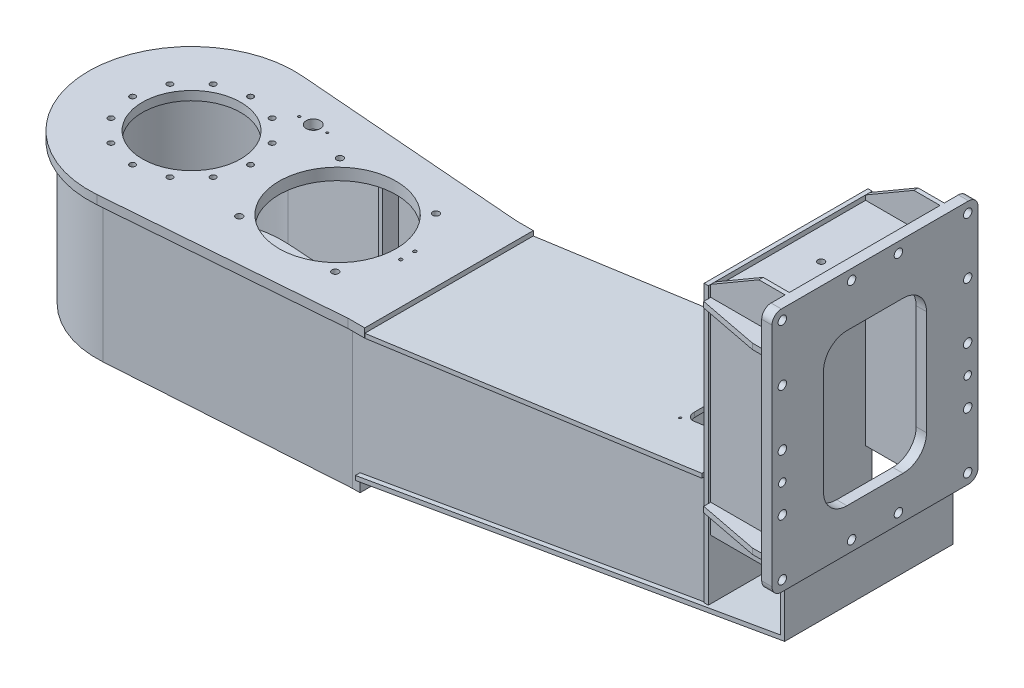
from build123d import *

# Parameters (mm, degrees)
SKETCH_1_R               = 203
SKETCH_1_R_2             = 194
EXTRUDE_1_DEPTH          = 301
CUT_EXTRUDE_1_DEPTH      = 416.955526469
CUT_EXTRUDE_1_DEPTH_BACK = 416.955526469
EXTRUDE_START            = 20
SKETCH_4_R               = 194
EXTRUDE_2_DEPTH          = 20
EXTRUDE_3_DEPTH          = 20
SKETCH_7_R               = 159
CUT_EXTRUDE_3_DEPTH      = 20
CUT_EXTRUDE_5_DEPTH      = 20
FILLET_1_R               = 25
EXTRUDE_4_DEPTH          = 301
SKETCH_11_R              = 220
EXTRUDE_5_DEPTH          = 19
EXTRUDE_6_DEPTH          = 19
SKETCH_13_W              = 300
SKETCH_13_H              = 270
EXTRUDE_7_DEPTH          = 6
EXTRUDE_8_DEPTH          = 12
CUT_EXTRUDE_7_DEPTH      = 12
EXTRUDE_9_DEPTH          = 9
EXTRUDE_10_DEPTH         = 9
EXTRUDE_11_DEPTH         = 180
EXTRUDE_11_DEPTH_BACK    = 180
EXTRUDE_12_DEPTH         = 180
EXTRUDE_12_DEPTH_BACK    = 180
EXTRUDE_13_DEPTH         = 161
EXTRUDE_13_DEPTH_BACK    = 161
CUT_EXTRUDE_8_DEPTH      = 9
SKETCH_31_W              = 350
SKETCH_31_H              = 591
EXTRUDE_14_DEPTH         = 9
EXTRUDE_16_DEPTH         = 9
EXTRUDE_17_DEPTH         = 9
EXTRUDE_18_DEPTH         = 12
EXTRUDE_19_DEPTH         = 12
SKETCH_43_W              = 159
SKETCH_43_H              = 322
EXTRUDE_20_DEPTH         = 12
EXTRUDE_21_DEPTH         = 22
CUT_EXTRUDE_10_DEPTH     = 22
EXTRUDE_22_DEPTH         = 301
SKETCH_50_R              = 105
CUT_EXTRUDE_12_DEPTH     = 19
SKETCH_52_R              = 6
CUT_EXTRUDE_14_DEPTH     = 19
SKETCH_54_R              = 15
CUT_EXTRUDE_16_DEPTH     = 19
SKETCH_56_R              = 2.5
CUT_EXTRUDE_18_DEPTH     = 19
SKETCH_59_R              = 125
CUT_EXTRUDE_20_DEPTH     = 25
SKETCH_61_R              = 7
CUT_EXTRUDE_22_DEPTH     = 25
SKETCH_63_R              = 3.4
CUT_EXTRUDE_24_DEPTH     = 25
CUT_EXTRUDE_25_DEPTH     = 9
SKETCH_65_R              = 2.5
CUT_EXTRUDE_26_DEPTH     = 9
SKETCH_67_R              = 65
CUT_EXTRUDE_28_DEPTH     = 9
SKETCH_69_R              = 2.5
CUT_EXTRUDE_30_DEPTH     = 9
SKETCH_71_R              = 7
CUT_EXTRUDE_32_DEPTH     = 12
SKETCH_73_R              = 9
CUT_EXTRUDE_34_DEPTH     = 22
SKETCH_75_R              = 8
CUT_EXTRUDE_36_DEPTH     = 22


with BuildPart() as part:
    # ｽｹｯﾁ1 → ﾎﾞｽ - 押し出し1 (new body)
    with BuildSketch(Plane(origin=(0, 0, 0), x_dir=(1, 0, 0), z_dir=(0, 1, 0))):
        with Locations(Location((0, 0, 0), (0, 0, 270))):
            Circle(SKETCH_1_R)
        with Locations(Location((0, 0, 0), (0, 0, 270))):
            Circle(SKETCH_1_R_2, mode=Mode.SUBTRACT)
    extrude(amount=-EXTRUDE_1_DEPTH)

    # ｽｹｯﾁ2 → ｶｯﾄ - 押し出し1 (cut, two sides: drawn at the far end of the back side and taken through both)
    with BuildSketch(Plane(origin=(0, 0, 0), x_dir=(1, 0, 0), z_dir=(0, 1, 0)).offset(-CUT_EXTRUDE_1_DEPTH_BACK)):
        Polygon((0, 0), (16.224897935, -249.47294981), (300, -249.47294981), (300, 249.47294981), (16.224897935, 249.47294981), align=None)
    extrude(amount=CUT_EXTRUDE_1_DEPTH + CUT_EXTRUDE_1_DEPTH_BACK, mode=Mode.SUBTRACT)

    # ｽｹｯﾁ4 → ﾎﾞｽ - 押し出し2 (add)
    with BuildSketch(Plane(origin=(0, -301, 0), x_dir=(1, 0, 0), z_dir=(0, 1, 0)).offset(EXTRUDE_START)):
        Circle(SKETCH_4_R)
    extrude(amount=-EXTRUDE_2_DEPTH)

    # ｽｹｯﾁ5 → ﾎﾞｽ - 押し出し3 (add)
    with BuildSketch(Plane(origin=(0, -301, 0), x_dir=(1, 0, 0), z_dir=(0, 1, 0))):
        Polygon((12.590520797, -193.591009053), (513.7, -161), (518, -161), (518, 161), (513.7, 161), (12.590520797, 193.591009053), align=None)
    extrude(amount=EXTRUDE_3_DEPTH)

    # ｽｹｯﾁ7 → ｶｯﾄ - 押し出し3 (cut)
    with BuildSketch(Plane(origin=(0, -301, 0), x_dir=(1, 0, 0), z_dir=(0, 1, 0))):
        with Locations(Location((0, 0, 0), (0, 0, 270))):
            Circle(SKETCH_7_R)
    extrude(amount=CUT_EXTRUDE_3_DEPTH, mode=Mode.SUBTRACT)

    # ｽｹｯﾁ9 → ｶｯﾄ - 押し出し5 (cut)
    with BuildSketch(Plane(origin=(0, -301, 0), x_dir=(1, 0, 0), z_dir=(0, 1, 0))):
        Polygon((10.319035087, -158.664796079), (468.0175, -128.897597336), (468.0175, 128.897597336), (10.319035087, 158.664796079), align=None)
    extrude(amount=CUT_EXTRUDE_5_DEPTH, mode=Mode.SUBTRACT)

    # ﾌｨﾚｯﾄ1
    fillet_1_edges = [part.edges().sort_by_distance(p)[0] for p in [
        (468.0175, -291, 128.897597336),
        (468.0175, -291, -128.897597336),
    ]]
    fillet(fillet_1_edges, radius=FILLET_1_R)

    # ｽｹｯﾁ10 → ﾎﾞｽ - 押し出し4 (add)
    with BuildSketch(Plane(origin=(0, 0, 0), x_dir=(1, 0, 0), z_dir=(0, 1, 0))):
        Polygon((12.590520797, 193.591009053), (513.7, 161), (530, 161), (530, 170), (514, 170), (13.174617123, 202.572035246), align=None)
        Polygon((12.590520797, -193.591009053), (513.7, -161), (530, -161), (530, -170), (514, -170), (13.174617123, -202.572035246), align=None)
    extrude(amount=-EXTRUDE_4_DEPTH)

    # ｽｹｯﾁ11 → ﾎﾞｽ - 押し出し5 (add)
    with BuildSketch(Plane(origin=(0, 0, 0), x_dir=(1, 0, 0), z_dir=(0, 1, 0))):
        with Locations(Location((0, 0, 0), (0, 0, 63.607016217))):
            Circle(SKETCH_11_R)
    extrude(amount=EXTRUDE_5_DEPTH)

    # ｽｹｯﾁ12 → ﾎﾞｽ - 押し出し6 (add)
    with BuildSketch(Plane(origin=(0, 0, 0), x_dir=(1, 0, 0), z_dir=(0, 1, 0))):
        Polygon((17.350560709, -219.314746524), (514.3, -180), (550, -180), (550, 180), (514.3, 180), (17.350560709, 219.314746524), align=None)
    extrude(amount=EXTRUDE_6_DEPTH)

    # ｽｹｯﾁ13 → ﾎﾞｽ - 押し出し7 (add)
    with BuildSketch(Plane(origin=(0, 0, 0), x_dir=(1, 0, 0), z_dir=(0, 1, 0))):
        with Locations((325, 0)):
            Rectangle(SKETCH_13_W, SKETCH_13_H)
    extrude(amount=-EXTRUDE_7_DEPTH)

    # ｽｹｯﾁ15 → ﾎﾞｽ - 押し出し8 (add)
    with BuildSketch(Plane(origin=(518, 0, 0), x_dir=(0, 0, -1), z_dir=(1, 0, 0))):
        Polygon((161, -301), (-161, -301), (-161, -7), (-151, 3), (151, 3), (161, -7), align=None)
    extrude(amount=EXTRUDE_8_DEPTH)

    # ｽｹｯﾁ17 → ｶｯﾄ - 押し出し7 (cut)
    with BuildSketch(Plane(origin=(518, 0, 0), x_dir=(0, 0, -1), z_dir=(1, 0, 0))):
        with BuildLine():
            Line((-111, -220), (-111, -97))
            ThreePointArc((-111, -97), (-102.213203436, -75.786796564), (-81, -67))
            Line((-81, -67), (81, -67))
            ThreePointArc((81, -67), (102.213203436, -75.786796564), (111, -97))
            Line((111, -97), (111, -220))
            ThreePointArc((111, -220), (102.213203436, -241.213203436), (81, -250))
            Line((81, -250), (-81, -250))
            ThreePointArc((-81, -250), (-102.213203436, -241.213203436), (-111, -220))
        make_face()
    extrude(amount=CUT_EXTRUDE_7_DEPTH, mode=Mode.SUBTRACT)

    # ｽｹｯﾁ20 → ﾎﾞｽ - 押し出し9 (add)
    with BuildSketch(Plane.XY.offset(161)):
        Polygon((530, -273.136944141), (1270, -143.555446343), (1270, 109.988063889), (530, 6.215108965), align=None)
    extrude(amount=EXTRUDE_9_DEPTH)

    # ｽｹｯﾁ21 → ﾎﾞｽ - 押し出し10 (add)
    with BuildSketch(Plane.XY.offset(-161)):
        Polygon((530, -273.136944141), (1270, -143.555446343), (1270, 109.988063889), (530, 6.215108965), align=None)
    extrude(amount=-EXTRUDE_10_DEPTH)

    # ｽｹｯﾁ22 → ﾎﾞｽ - 押し出し11 (add, two sides: drawn at the far end of the back side and taken through both)
    with BuildSketch(Plane.XY.offset(-EXTRUDE_11_DEPTH_BACK)):
        Polygon((551.2, 0.1), (1270, 100.9), (1270, 109.988063889), (549.950126354, 9.012789455), align=None)
    extrude(amount=EXTRUDE_11_DEPTH + EXTRUDE_11_DEPTH_BACK)

    # ｽｹｯﾁ23 → ﾎﾞｽ - 押し出し12 (add, two sides: drawn at the far end of the back side and taken through both)
    with BuildSketch(Plane.XY.offset(-EXTRUDE_12_DEPTH_BACK)):
        Polygon((530, -264), (1438, -105), (1438, -5), (1447, -5), (1447, -112.560952951), (530, -273.136944141), align=None)
    extrude(amount=EXTRUDE_12_DEPTH + EXTRUDE_12_DEPTH_BACK)

    # ｽｹｯﾁ24 → ﾎﾞｽ - 押し出し13 (add, two sides: drawn at the far end of the back side and taken through both)
    with BuildSketch(Plane.XY.offset(-EXTRUDE_13_DEPTH_BACK)):
        Polygon((909.050126354, 59.370719338), (917.962915808, 60.620592985), (954.346576527, -198.829559044), (945.476333395, -200.382828491), align=None)
    extrude(amount=EXTRUDE_13_DEPTH + EXTRUDE_13_DEPTH_BACK)

    # ｽｹｯﾁ29 → ｶｯﾄ - 押し出し8 (cut)
    with BuildSketch(Plane(origin=(908.595975782, 127.41579627, 0), x_dir=(0, 0, -1), z_dir=(0.9903099394368974, 0.1388748496038389, 0))):
        with BuildLine():
            Line((81, -270.017190662), (-81, -270.017190662))
            ThreePointArc((-81, -270.017190662), (-102.213203436, -261.230394097), (-111, -240.017190662))
            Line((-111, -240.017190662), (-111, -157.017190662))
            ThreePointArc((-111, -157.017190662), (-102.213203436, -135.803987226), (-81, -127.017190662))
            Line((-81, -127.017190662), (81, -127.017190662))
            ThreePointArc((81, -127.017190662), (102.213203436, -135.803987226), (111, -157.017190662))
            Line((111, -157.017190662), (111, -240.017190662))
            ThreePointArc((111, -240.017190662), (102.213203436, -261.230394097), (81, -270.017190662))
        make_face()
    extrude(amount=-CUT_EXTRUDE_8_DEPTH, mode=Mode.SUBTRACT)

    # ｽｹｯﾁ31 → ﾎﾞｽ - 押し出し14 (add)
    with BuildSketch(Plane(origin=(1270, 0, 0), x_dir=(0, 0, -1), z_dir=(1, 0, 0))):
        with Locations((0, 163.5)):
            Rectangle(SKETCH_31_W, SKETCH_31_H)
    extrude(amount=EXTRUDE_14_DEPTH)

    # ｽｹｯﾁ36 → ﾎﾞｽ - 押し出し16 (add)
    with BuildSketch(Plane.XY.offset(161)):
        Polygon((1279, -5), (1460, -5), (1460, 519), (1382, 519), (1279, 459), align=None)
    extrude(amount=EXTRUDE_16_DEPTH)

    # ｽｹｯﾁ37 → ﾎﾞｽ - 押し出し17 (add)
    with BuildSketch(Plane.XY.offset(-161)):
        Polygon((1279, -5), (1460, -5), (1460, 519), (1382, 519), (1279, 459), align=None)
    extrude(amount=-EXTRUDE_17_DEPTH)

    # ｽｹｯﾁ39 → ﾎﾞｽ - 押し出し18 (add)
    with BuildSketch(Plane(origin=(0, 44, 0), x_dir=(1, 0, 0), z_dir=(0, 1, 0))):
        Polygon((1279, 170), (1431, 170), (1438, 177), (1438, 203), (1431, 210), (1408, 210), (1279, 185), align=None)
        Polygon((1279, -170), (1431, -170), (1438, -177), (1438, -203), (1431, -210), (1408, -210), (1279, -185), align=None)
    extrude(amount=EXTRUDE_18_DEPTH)

    # ｽｹｯﾁ41 → ﾎﾞｽ - 押し出し19 (add)
    with BuildSketch(Plane(origin=(0, 423, 0), x_dir=(1, 0, 0), z_dir=(0, 1, 0))):
        Polygon((1279, 170), (1431, 170), (1438, 177), (1438, 203), (1431, 210), (1408, 210), (1279, 185), align=None)
        Polygon((1279, -170), (1431, -170), (1438, -177), (1438, -203), (1431, -210), (1408, -210), (1279, -185), align=None)
    extrude(amount=EXTRUDE_19_DEPTH)

    # ｽｹｯﾁ43 → ﾎﾞｽ - 押し出し20 (add)
    with BuildSketch(Plane(origin=(0, 437, 0), x_dir=(1, 0, 0), z_dir=(0, 1, 0))):
        with Locations((1358.5, 0)):
            Rectangle(SKETCH_43_W, SKETCH_43_H)
    extrude(amount=EXTRUDE_20_DEPTH)

    # ｽｹｯﾁ45 → ﾎﾞｽ - 押し出し21 (add)
    with BuildSketch(Plane(origin=(1438, 0, 0), x_dir=(0, 0, -1), z_dir=(1, 0, 0))):
        with BuildLine():
            Line((-220, 15), (-220, 499))
            ThreePointArc((-220, 499), (-214.142135624, 513.142135624), (-200, 519))
            Line((-200, 519), (200, 519))
            ThreePointArc((200, 519), (214.142135624, 513.142135624), (220, 499))
            Line((220, 499), (220, 15))
            ThreePointArc((220, 15), (214.142135624, 0.857864376), (200, -5))
            Line((200, -5), (-200, -5))
            ThreePointArc((-200, -5), (-214.142135624, 0.857864376), (-220, 15))
        make_face()
    extrude(amount=EXTRUDE_21_DEPTH)

    # ｽｹｯﾁ47 → ｶｯﾄ - 押し出し10 (cut)
    with BuildSketch(Plane(origin=(1438, 0, 0), x_dir=(0, 0, -1), z_dir=(1, 0, 0))):
        with BuildLine():
            Line((-110, 135), (-110, 359))
            ThreePointArc((-110, 359), (-95.355339059, 394.355339059), (-60, 409))
            Line((-60, 409), (60, 409))
            ThreePointArc((60, 409), (95.355339059, 394.355339059), (110, 359))
            Line((110, 359), (110, 135))
            ThreePointArc((110, 135), (95.355339059, 99.644660941), (60, 85))
            Line((60, 85), (-60, 85))
            ThreePointArc((-60, 85), (-95.355339059, 99.644660941), (-110, 135))
        make_face()
    extrude(amount=CUT_EXTRUDE_10_DEPTH, mode=Mode.SUBTRACT)

    # ｽｹｯﾁ48 → ﾎﾞｽ - 押し出し22 (add)
    with BuildSketch(Plane(origin=(0, 0, 0), x_dir=(1, 0, 0), z_dir=(0, 1, 0))):
        Polygon((253.6175, 145.9656), (262.6175, 145.3656), (264.7175, 177.193501799), (255.7175, 177.778832118), align=None)
        Polygon((253.6175, -145.9656), (262.6175, -145.3656), (264.7175, -177.193501799), (255.7175, -177.778832118), align=None)
    extrude(amount=-EXTRUDE_22_DEPTH)

    # ｽｹｯﾁ50 → ｶｯﾄ - 押し出し12 (cut)
    with BuildSketch(Plane(origin=(0, 0, 0), x_dir=(1, 0, 0), z_dir=(0, 1, 0))):
        with Locations(Location((0, 0, 0), (0, 0, 270))):
            Circle(SKETCH_50_R)
    extrude(amount=CUT_EXTRUDE_12_DEPTH, mode=Mode.SUBTRACT)

    # ｽｹｯﾁ52 → ｶｯﾄ - 押し出し14 (cut)
    with BuildSketch(Plane(origin=(0, 0, 0), x_dir=(1, 0, 0), z_dir=(0, 1, 0))):
        with Locations(Location((126, 0, 0), (0, 0, 270))):
            Circle(SKETCH_52_R)
        with Locations(Location((109.119200877, -63, 0), (0, 0, 270))):
            Circle(SKETCH_52_R)
        with Locations(Location((63, -109.119200877, 0), (0, 0, 270))):
            Circle(SKETCH_52_R)
        with Locations(Location((0, -126, 0), (0, 0, 270))):
            Circle(SKETCH_52_R)
        with Locations(Location((-63, -109.119200877, 0), (0, 0, 270))):
            Circle(SKETCH_52_R)
        with Locations(Location((-109.119200877, -63, 0), (0, 0, 270))):
            Circle(SKETCH_52_R)
        with Locations(Location((-126, 0, 0), (0, 0, 270))):
            Circle(SKETCH_52_R)
        with Locations(Location((-109.119200877, 63, 0), (0, 0, 270))):
            Circle(SKETCH_52_R)
        with Locations(Location((-63, 109.119200877, 0), (0, 0, 270))):
            Circle(SKETCH_52_R)
        with Locations(Location((0, 126, 0), (0, 0, 270))):
            Circle(SKETCH_52_R)
        with Locations(Location((63, 109.119200877, 0), (0, 0, 270))):
            Circle(SKETCH_52_R)
        with Locations(Location((109.119200877, 63, 0), (0, 0, 270))):
            Circle(SKETCH_52_R)
    extrude(amount=CUT_EXTRUDE_14_DEPTH, mode=Mode.SUBTRACT)

    # ｽｹｯﾁ54 → ｶｯﾄ - 押し出し16 (cut)
    with BuildSketch(Plane(origin=(0, 0, 0), x_dir=(1, 0, 0), z_dir=(0, 1, 0))):
        with Locations(Location((119, 141, 0), (0, 0, 270))):
            Circle(SKETCH_54_R)
    extrude(amount=CUT_EXTRUDE_16_DEPTH, mode=Mode.SUBTRACT)

    # ｽｹｯﾁ56 → ｶｯﾄ - 押し出し18 (cut)
    with BuildSketch(Plane(origin=(0, 0, 0), x_dir=(1, 0, 0), z_dir=(0, 1, 0))):
        with Locations(Location((89, 141, 0), (0, 0, 270))):
            Circle(SKETCH_56_R)
        with Locations(Location((149, 141, 0), (0, 0, 270))):
            Circle(SKETCH_56_R)
    extrude(amount=CUT_EXTRUDE_18_DEPTH, mode=Mode.SUBTRACT)

    # ｽｹｯﾁ59 → ｶｯﾄ - 押し出し20 (cut)
    with BuildSketch(Plane(origin=(0, -6, 0), x_dir=(1, 0, 0), z_dir=(0, 1, 0))):
        with Locations(Location((312, 0, 0), (0, 0, 270))):
            Circle(SKETCH_59_R)
    extrude(amount=CUT_EXTRUDE_20_DEPTH, mode=Mode.SUBTRACT)

    # ｽｹｯﾁ61 → ｶｯﾄ - 押し出し22 (cut)
    with BuildSketch(Plane(origin=(0, -6, 0), x_dir=(1, 0, 0), z_dir=(0, 1, 0))):
        with Locations(Location((209.5, 107.5, 0), (0, 0, 270))):
            Circle(SKETCH_61_R)
        with Locations(Location((209.5, -107.5, 0), (0, 0, 270))):
            Circle(SKETCH_61_R)
        with Locations(Location((414.5, 107.5, 0), (0, 0, 270))):
            Circle(SKETCH_61_R)
        with Locations(Location((414.5, -107.5, 0), (0, 0, 270))):
            Circle(SKETCH_61_R)
    extrude(amount=CUT_EXTRUDE_22_DEPTH, mode=Mode.SUBTRACT)

    # ｽｹｯﾁ63 → ｶｯﾄ - 押し出し24 (cut)
    with BuildSketch(Plane(origin=(0, -6, 0), x_dir=(1, 0, 0), z_dir=(0, 1, 0))):
        with Locations(Location((462, 15, 0), (0, 0, 270))):
            Circle(SKETCH_63_R)
        with Locations(Location((462, -15, 0), (0, 0, 270))):
            Circle(SKETCH_63_R)
    extrude(amount=CUT_EXTRUDE_24_DEPTH, mode=Mode.SUBTRACT)

    # ｽｹｯﾁ64 → ｶｯﾄ - 押し出し25 (cut)
    with BuildSketch(Plane(origin=(9.366940027, -66.795203285, 0), x_dir=(0.9903099394368974, 0.13887484960383872, 0), z_dir=(-0.1388748496038387, 0.9903099394368973, 0))):
        with BuildLine():
            Line((1205.576858653, 55), (1205.576858653, -55))
            ThreePointArc((1205.576858653, -55), (1199.718994277, -69.142135624), (1185.576858653, -75))
            Line((1185.576858653, -75), (1150.576858653, -75))
            ThreePointArc((1150.576858653, -75), (1136.434723029, -69.142135624), (1130.576858653, -55))
            Line((1130.576858653, -55), (1130.576858653, 55))
            ThreePointArc((1130.576858653, 55), (1136.434723029, 69.142135624), (1150.576858653, 75))
            Line((1150.576858653, 75), (1185.576858653, 75))
            ThreePointArc((1185.576858653, 75), (1199.718994277, 69.142135624), (1205.576858653, 55))
        make_face()
    extrude(amount=-CUT_EXTRUDE_25_DEPTH, mode=Mode.SUBTRACT)

    # ｽｹｯﾁ65 → ｶｯﾄ - 押し出し26 (cut)
    with BuildSketch(Plane(origin=(9.366940027, -66.795203285, 0), x_dir=(0.9903099394368974, 0.13887484960383872, 0), z_dir=(-0.1388748496038387, 0.9903099394368973, 0))):
        with Locations(Location((1125.576858653, 80, 0), (0, 0, 180))):
            Circle(SKETCH_65_R)
        with Locations(Location((1125.576858653, -80, 0), (0, 0, 180))):
            Circle(SKETCH_65_R)
        with Locations(Location((1210.576858653, 80, 0), (0, 0, 180))):
            Circle(SKETCH_65_R)
        with Locations(Location((1210.576858653, -80, 0), (0, 0, 180))):
            Circle(SKETCH_65_R)
    extrude(amount=-CUT_EXTRUDE_26_DEPTH, mode=Mode.SUBTRACT)

    # ｽｹｯﾁ67 → ｶｯﾄ - 押し出し28 (cut)
    with BuildSketch(Plane(origin=(1270, 0, 0), x_dir=(0, 0, -1), z_dir=(1, 0, 0))):
        with Locations((0, 319)):
            Circle(SKETCH_67_R)
    extrude(amount=CUT_EXTRUDE_28_DEPTH, mode=Mode.SUBTRACT)

    # ｽｹｯﾁ69 → ｶｯﾄ - 押し出し30 (cut)
    with BuildSketch(Plane(origin=(1270, 0, 0), x_dir=(0, 0, -1), z_dir=(1, 0, 0))):
        with Locations((-53.033008589, 372.033008589)):
            Circle(SKETCH_69_R)
        with Locations((53.033008589, 372.033008589)):
            Circle(SKETCH_69_R)
        with Locations((53.033008589, 265.966991411)):
            Circle(SKETCH_69_R)
        with Locations((-53.033008589, 265.966991411)):
            Circle(SKETCH_69_R)
    extrude(amount=CUT_EXTRUDE_30_DEPTH, mode=Mode.SUBTRACT)

    # ｽｹｯﾁ71 → ｶｯﾄ - 押し出し32 (cut)
    with BuildSketch(Plane(origin=(0, 437, 0), x_dir=(1, 0, 0), z_dir=(0, 1, 0))):
        with Locations(Location((1345, 0, 0), (0, 0, 270))):
            Circle(SKETCH_71_R)
    extrude(amount=CUT_EXTRUDE_32_DEPTH, mode=Mode.SUBTRACT)

    # ｽｹｯﾁ73 → ｶｯﾄ - 押し出し34 (cut)
    with BuildSketch(Plane(origin=(1438, 0, 0), x_dir=(0, 0, -1), z_dir=(1, 0, 0))):
        with Locations((198, 17)):
            Circle(SKETCH_73_R)
        with Locations((198, 137)):
            Circle(SKETCH_73_R)
        with Locations((198, 257)):
            Circle(SKETCH_73_R)
        with Locations((198, 377)):
            Circle(SKETCH_73_R)
        with Locations((198, 497)):
            Circle(SKETCH_73_R)
        with Locations((-198, 17)):
            Circle(SKETCH_73_R)
        with Locations((-198, 137)):
            Circle(SKETCH_73_R)
        with Locations((-198, 257)):
            Circle(SKETCH_73_R)
        with Locations((-198, 377)):
            Circle(SKETCH_73_R)
        with Locations((-198, 497)):
            Circle(SKETCH_73_R)
        with Locations((50, 17)):
            Circle(SKETCH_73_R)
        with Locations((50, 497)):
            Circle(SKETCH_73_R)
        with Locations((-50, 17)):
            Circle(SKETCH_73_R)
        with Locations((-50, 497)):
            Circle(SKETCH_73_R)
    extrude(amount=CUT_EXTRUDE_34_DEPTH, mode=Mode.SUBTRACT)

    # ｽｹｯﾁ75 → ｶｯﾄ - 押し出し36 (cut)
    with BuildSketch(Plane(origin=(1438, 0, 0), x_dir=(0, 0, -1), z_dir=(1, 0, 0))):
        with Locations((198, 197)):
            Circle(SKETCH_75_R)
        with Locations((-198, 197)):
            Circle(SKETCH_75_R)
    extrude(amount=CUT_EXTRUDE_36_DEPTH, mode=Mode.SUBTRACT)


solid = part.part
